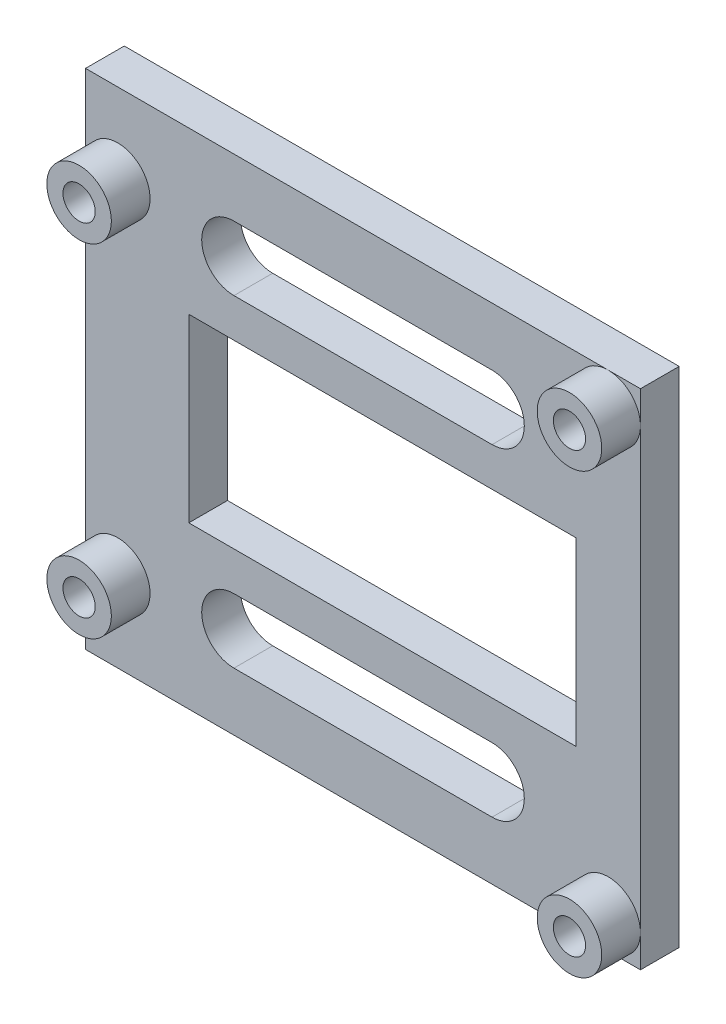
from build123d import *

# Parameters (mm, degrees)
SCHIZZO1_W                   = 43
SCHIZZO1_H                   = 39
ESTRUSIONE_ESTRUSIONE1_DEPTH = 3
SCHIZZO2_R                   = 2.5
ESTRUSIONE_ESTRUSIONE2_DEPTH = 3
SCHIZZO3_R                   = 1.25
TAGLIO_ESTRUSIONE1_DEPTH     = 30.639500671
SCHIZZO4_W                   = 30
SCHIZZO4_H                   = 14
TAGLIO_ESTRUSIONE2_DEPTH     = 30.180472923


with BuildPart() as part:
    # Schizzo1 → Estrusione-Estrusione1 (new body)
    with BuildSketch(Plane.XY):
        Rectangle(SCHIZZO1_W, SCHIZZO1_H)
    extrude(amount=ESTRUSIONE_ESTRUSIONE1_DEPTH)

    # Schizzo2 → Estrusione-Estrusione2 (add)
    with BuildSketch(Plane.XY.offset(3)):
        with Locations((19, 17)):
            Circle(SCHIZZO2_R)
        with Locations(Location((-19, 13.25, 0), (0, 0, 180))):
            Circle(SCHIZZO2_R)
        with Locations((19, -17)):
            Circle(SCHIZZO2_R)
        with Locations(Location((-19, -13.25, 0), (0, 0, 180))):
            Circle(SCHIZZO2_R)
    extrude(amount=ESTRUSIONE_ESTRUSIONE2_DEPTH)

    # Schizzo3 → Taglio-Estrusione1 (cut, through all)
    with BuildSketch(Plane.XY.offset(6)):
        with Locations((-19, 13.25)):
            Circle(SCHIZZO3_R)
        with Locations((19, 17)):
            Circle(SCHIZZO3_R)
        with Locations((19, -17)):
            Circle(SCHIZZO3_R)
        with Locations((-19, -13.25)):
            Circle(SCHIZZO3_R)
    extrude(amount=-TAGLIO_ESTRUSIONE1_DEPTH, mode=Mode.SUBTRACT)

    # Schizzo4 → Taglio-Estrusione2 (cut, through all)
    with BuildSketch(Plane.XY.offset(3)):
        with BuildLine():
            Line((-10, 15), (10, 15))
            ThreePointArc((10, 15), (12.5, 12.5), (10, 10))
            Line((10, 10), (-10, 10))
            ThreePointArc((-10, 10), (-12.5, 12.5), (-10, 15))
        make_face()
        with Locations((1.5, 0)):
            Rectangle(SCHIZZO4_W, SCHIZZO4_H)
        with BuildLine():
            Line((-10, -15), (10, -15))
            ThreePointArc((10, -15), (12.5, -12.5), (10, -10))
            Line((10, -10), (-10, -10))
            ThreePointArc((-10, -10), (-12.5, -12.5), (-10, -15))
        make_face()
    extrude(amount=-TAGLIO_ESTRUSIONE2_DEPTH, mode=Mode.SUBTRACT)


solid = part.part
